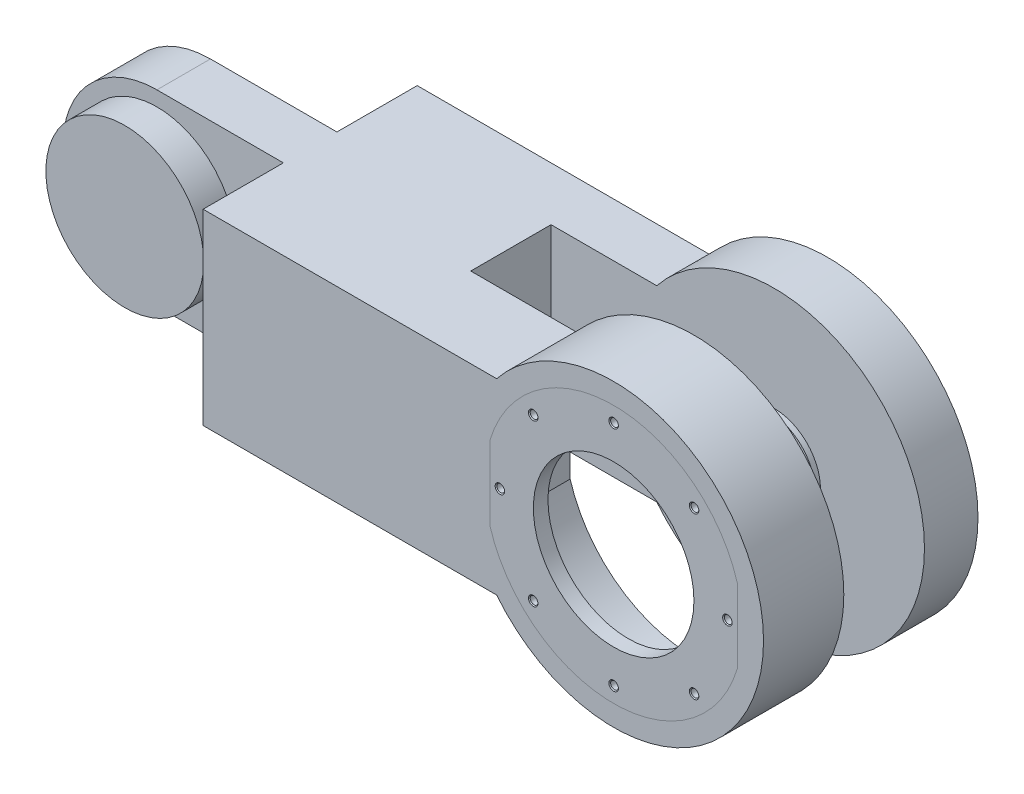
from build123d import *

# Parameters (mm, degrees)
SKETCH_1_W               = 100
SKETCH_1_H               = 70
EXTRUDE_1_DEPTH          = 40
SKETCH_2_R               = 32
EXTRUDE_2_DEPTH          = 10
EXTRUDE_START            = -8
SKETCH_6_R               = 32
EXTRUDE_3_DEPTH          = 8
SKETCH_7_W               = 10
SKETCH_7_H               = 70
CUT_EXTRUDE_1_DEPTH      = 30
SKETCH_9_W               = 10
SKETCH_9_H               = 70
CUT_EXTRUDE_2_DEPTH      = 30
SKETCH_11_R              = 29.5
EXTRUDE_4_DEPTH          = 12
EXTRUDE_5_DEPTH          = 30
EXTRUDE_6_DEPTH          = 5.45
SKETCH_13_R              = 30
CUT_EXTRUDE_4_DEPTH      = 6
PATTERN_CIRCULAR_1_COUNT = 8
PATTERN_CIRCULAR_2_COUNT = 6
EXTRUDE_7_DEPTH          = 20
SKETCH_19_R              = 17.25
EXTRUDE_8_DEPTH          = 2
SKETCH_22_W              = 30
SKETCH_22_H              = 70
CUT_EXTRUDE_6_DEPTH      = 20


with BuildPart() as part:
    # 草图1 → 凸台-拉伸1 (new, symmetric)
    with BuildSketch(Plane.XY):
        with Locations((-0.751513191, -13.921282279)):
            Rectangle(SKETCH_1_W, SKETCH_1_H)
    extrude(amount=EXTRUDE_1_DEPTH, both=True)

    # 草图2 → 凸台-拉伸2 (add, symmetric)
    with BuildSketch(Plane.XY):
        with BuildLine():
            Line((-50.751513191, 21.078717721), (-88.004548321, 21.078717721))
            ThreePointArc((-88.004548321, 21.078717721), (-123.004548321, -13.921282279), (-88.004548321, -48.921282279))
            Line((-88.004548321, -48.921282279), (-50.751513191, -48.921282279))
            Line((-50.751513191, -48.921282279), (-50.751513191, 21.078717721))
        make_face()
        with Locations((-88.004548321, -13.921282279)):
            Circle(SKETCH_2_R, mode=Mode.SUBTRACT)
    extrude(amount=EXTRUDE_2_DEPTH, both=True)

    # 草图6 → 凸台-拉伸3 (add)
    with BuildSketch(Plane.XY.offset(10).offset(EXTRUDE_START)):
        with Locations((-88.004548321, -13.921282279)):
            Circle(SKETCH_6_R)
    extrude(amount=EXTRUDE_3_DEPTH)

    # 草图7 → 切除-拉伸1 (cut)
    with BuildSketch(Plane(origin=(0, 0, -40), x_dir=(-1, 0, 0), z_dir=(0, 0, -1))):
        with Locations((45.751513191, -13.921282279)):
            Rectangle(SKETCH_7_W, SKETCH_7_H)
    extrude(amount=-CUT_EXTRUDE_1_DEPTH, mode=Mode.SUBTRACT)

    # 草图9 → 切除-拉伸2 (cut)
    with BuildSketch(Plane.XY.offset(40)):
        with Locations((-45.751513191, -13.921282279)):
            Rectangle(SKETCH_9_W, SKETCH_9_H)
    extrude(amount=-CUT_EXTRUDE_2_DEPTH, mode=Mode.SUBTRACT)

    # 草图11 → 凸台-拉伸4 (add)
    with BuildSketch(Plane.XY.offset(10)):
        with Locations((-88.004548321, -13.921282279)):
            Circle(SKETCH_11_R)
    extrude(amount=EXTRUDE_4_DEPTH)

    # 草图10 → 凸台-拉伸5 (add)
    with BuildSketch(Plane.XY.offset(40)):
        with BuildLine():
            Line((68.929616732, 21.078717721), (49.248486809, 21.078717721))
            Line((49.248486809, 21.078717721), (49.248486809, -48.921282279))
            Line((49.248486809, -48.921282279), (68.929616732, -48.921282279))
            ThreePointArc((68.929616732, -48.921282279), (168.644602721, -13.921282279), (68.929616732, 21.078717721))
        make_face()
        with BuildLine():
            Line((66.394602721, -27.669009364), (66.394602721, -0.173555194))
            ThreePointArc((66.394602721, -0.173555194), (112.644602721, 34.328717721), (158.894602721, -0.173555194))
            Line((158.894602721, -0.173555194), (158.894602721, -27.669009364))
            ThreePointArc((158.894602721, -27.669009364), (112.644602721, -62.171282279), (66.394602721, -27.669009364))
        make_face(mode=Mode.SUBTRACT)
    extrude(amount=-EXTRUDE_5_DEPTH)

    # 草图17 → M4 螺纹孔1 (revolve, cut)
    with BuildSketch(Plane(origin=(-70.754548321, -13.921282279, 2), x_dir=(0, 1, 0), z_dir=(1, 0, 0))):
        Polygon((0, 0), (0, 12.491420021), (1.65, 11.5), (1.65, 0.375), (2.025, 0), align=None)
    hole_wizard_m4_1 = revolve(axis=Axis((-70.754548321, -13.921282279, -4.35), (0, 0, 1)), mode=Mode.SUBTRACT)

    # 阵列(圆周)2: M4 螺纹孔1 ×6 about axis
    pattern_circular_2_axis = Axis((-88.004548321, -13.921282279, 0), (0, 0, 1))
    for i in range(1, PATTERN_CIRCULAR_2_COUNT):
        add(hole_wizard_m4_1.rotate(pattern_circular_2_axis, i * 360 / PATTERN_CIRCULAR_2_COUNT), mode=Mode.SUBTRACT)

    # 草图18 → 凸台-拉伸7 (add)
    with BuildSketch(Plane(origin=(0, 0, -40), x_dir=(-1, 0, 0), z_dir=(0, 0, -1))):
        with BuildLine():
            Line((-49.248486809, -48.921282279), (-49.248486809, 21.078717721))
            Line((-49.248486809, 21.078717721), (-68.75551318, 21.078717721))
            ThreePointArc((-68.75551318, 21.078717721), (-168.780617727, -13.921282279), (-68.75551318, -48.921282279))
            Line((-68.75551318, -48.921282279), (-49.248486809, -48.921282279))
        make_face()
    extrude(amount=-EXTRUDE_7_DEPTH)

    # 草图19 → 凸台-拉伸8 (add)
    with BuildSketch(Plane.XY.offset(-20)):
        with Locations(Location((112.644602721, -13.921282279, 0), (0, 0, 180))):
            Circle(SKETCH_19_R)
    extrude(amount=EXTRUDE_8_DEPTH)

    # 草图22 → 切除-拉伸6 (cut)
    with BuildSketch(Plane(origin=(49.248486809, 0, 0), x_dir=(0, 0, -1), z_dir=(1, 0, 0))):
        with Locations((5, -13.921282279)):
            Rectangle(SKETCH_22_W, SKETCH_22_H)
    extrude(amount=-CUT_EXTRUDE_6_DEPTH, mode=Mode.SUBTRACT)


with BuildPart() as body_2:
    # 草图12 → 凸台-拉伸6 (new body)
    with BuildSketch(Plane.XY.offset(40)):
        with BuildLine():
            Line((66.394602721, -0.173555194), (66.394602721, -27.669009364))
            ThreePointArc((66.394602721, -27.669009364), (112.644602721, -62.171282279), (158.894602721, -27.669009364))
            Line((158.894602721, -27.669009364), (158.894602721, -0.173555194))
            ThreePointArc((158.894602721, -0.173555194), (112.644602721, 34.328717721), (66.394602721, -0.173555194))
        make_face()
    extrude(amount=-EXTRUDE_6_DEPTH)

    # 草图13 → 切除-拉伸4 (cut)
    with BuildSketch(Plane.XY.offset(40)):
        with Locations((112.644602721, -13.921282279)):
            Circle(SKETCH_13_R)
    extrude(amount=-CUT_EXTRUDE_4_DEPTH, mode=Mode.SUBTRACT)

    # 草图15 → M3.5 螺纹孔3 (revolve, cut)
    with BuildSketch(Plane(origin=(112.644602721, 28.578717721, 40), x_dir=(0, -1, 0), z_dir=(1, 0, 0))):
        Polygon((0, 0), (0, 23.871247898), (1.45, 23), (1.45, 0.325), (1.775, 0), align=None)
    hole_wizard_m3_5_3 = revolve(axis=Axis((112.644602721, 28.578717721, 46.35), (0, 0, -1)), mode=Mode.SUBTRACT)

    # 阵列(圆周)1: M3.5 螺纹孔3 ×8 about axis
    pattern_circular_1_axis = Axis((112.644602721, -13.921282279, 0), (0, 0, 1))
    for i in range(1, PATTERN_CIRCULAR_1_COUNT):
        add(hole_wizard_m3_5_3.rotate(pattern_circular_1_axis, i * 360 / PATTERN_CIRCULAR_1_COUNT), mode=Mode.SUBTRACT)


solid = Compound([part.part, body_2.part])
